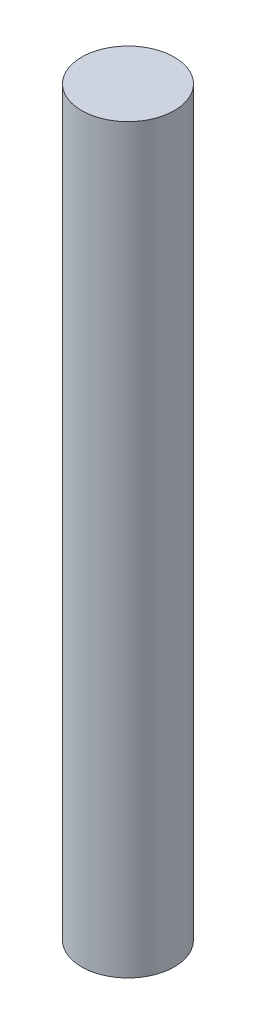
from build123d import *

# Parameters (mm, degrees)
SKETCH1_R           = 2.5
BOSS_EXTRUDE1_DEPTH = 40


with BuildPart() as part:
    # Sketch1 → Boss-Extrude1 (new body)
    with BuildSketch(Plane(origin=(0, 0, 0), x_dir=(1, 0, 0), z_dir=(0, 1, 0))):
        with Locations(Location((0, 0, 0), (0, 0, 270))):
            Circle(SKETCH1_R)
    extrude(amount=BOSS_EXTRUDE1_DEPTH)


solid = part.part
